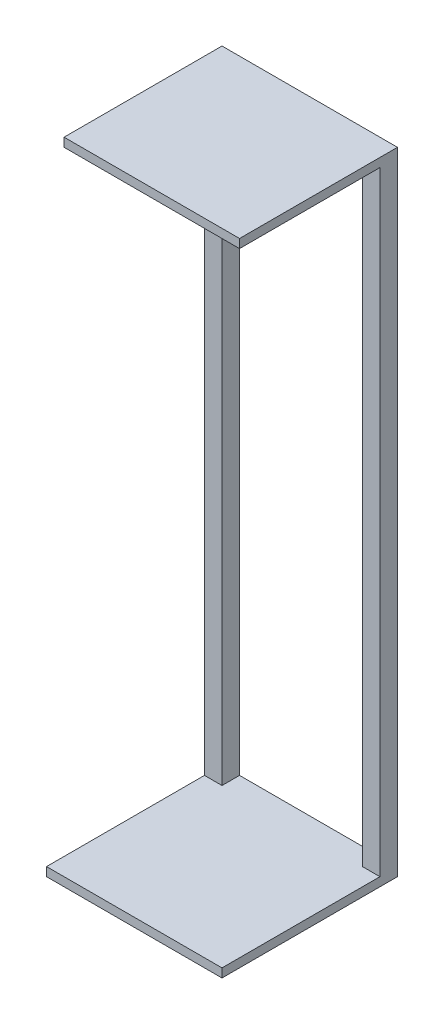
from build123d import *

# Parameters (mm, degrees)
SKETCH2_W           = 200
SKETCH2_H           = 200
BOSS_EXTRUDE1_DEPTH = 10
SKETCH3_W           = 20
SKETCH3_H           = 20
BOSS_EXTRUDE2_DEPTH = 700
SKETCH4_W           = 200
SKETCH4_H           = 180
BOSS_EXTRUDE3_DEPTH = 10
SKETCH5_W           = 40
SKETCH5_H           = 10
BOSS_EXTRUDE4_DEPTH = 20
SKETCH7_R           = 10
BOSS_EXTRUDE7_DEPTH = 40
SKETCH10_W          = 30
SKETCH10_H          = 40.281697436
CUT_EXTRUDE2_DEPTH  = 754.923072999
SKETCH11_R          = 5
BOSS_EXTRUDE9_DEPTH = 40
LPATTERN1_COUNT     = 2
LPATTERN1_PITCH     = 80


with BuildPart() as part:
    # Sketch2 → Boss-Extrude1 (new body)
    with BuildSketch(Plane(origin=(0, 0, 0), x_dir=(1, 0, 0), z_dir=(0, 1, 0))):
        with Locations((100, 100)):
            Rectangle(SKETCH2_W, SKETCH2_H)
    extrude(amount=BOSS_EXTRUDE1_DEPTH)

    # Sketch3 → Boss-Extrude2 (add)
    with BuildSketch(Plane(origin=(0, 10, 0), x_dir=(1, 0, 0), z_dir=(0, 1, 0))):
        with Locations((190, 190)):
            Rectangle(SKETCH3_W, SKETCH3_H)
        with Locations((10, 190)):
            Rectangle(SKETCH3_W, SKETCH3_H)
    extrude(amount=BOSS_EXTRUDE2_DEPTH)

    # Sketch4 → Boss-Extrude3 (add)
    with BuildSketch(Plane(origin=(0, 710, 0), x_dir=(1, 0, 0), z_dir=(0, 1, 0))):
        with Locations((100, 110)):
            Rectangle(SKETCH4_W, SKETCH4_H)
    extrude(amount=BOSS_EXTRUDE3_DEPTH)

    # Sketch5 → Boss-Extrude4 (add)
    with BuildSketch(Plane.XZ.offset(-710)):
        with Locations((100, -105)):
            Rectangle(SKETCH5_W, SKETCH5_H)
        with Locations((100, -115)):
            Rectangle(SKETCH5_W, SKETCH5_H)
    boss_extrude4 = extrude(amount=BOSS_EXTRUDE4_DEPTH)

    # Sketch7 → Boss-Extrude7 (add)
    with BuildSketch(Plane(origin=(120, 0, 0), x_dir=(0, 0, -1), z_dir=(1, 0, 0))):
        with Locations((110, 690)):
            Circle(SKETCH7_R)
    boss_extrude7 = extrude(amount=-BOSS_EXTRUDE7_DEPTH)

    # Sketch10 → Cut-Extrude2 (cut, through all)
    with BuildSketch(Plane.XY.offset(-100)):
        with Locations((100, 689.859151282)):
            Rectangle(SKETCH10_W, SKETCH10_H)
    cut_extrude2 = extrude(amount=-CUT_EXTRUDE2_DEPTH, mode=Mode.SUBTRACT)

    # Sketch11 → Boss-Extrude9 (add)
    with BuildSketch(Plane(origin=(120, 0, 0), x_dir=(0, 0, -1), z_dir=(1, 0, 0))):
        with Locations((110, 690)):
            Circle(SKETCH11_R)
    boss_extrude9 = extrude(amount=-BOSS_EXTRUDE9_DEPTH)

    # LPattern1: Boss-Extrude4, Boss-Extrude7, Cut-Extrude2, Boss-Extrude9 ×2
    with Locations(*[(0, 0, -i * LPATTERN1_PITCH) for i in range(1, LPATTERN1_COUNT)]):
        add(boss_extrude4)
        add(boss_extrude7)
        add(cut_extrude2, mode=Mode.SUBTRACT)
        add(boss_extrude9)


solid = part.part
